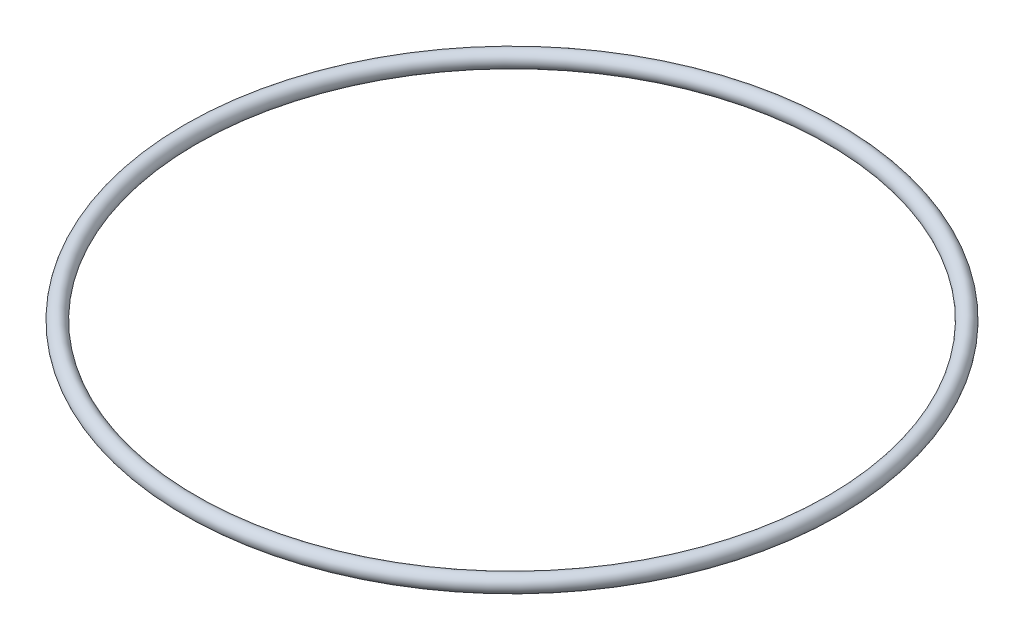
from build123d import *

# Parameters (mm, degrees)
SKETCH9_R = 0.889


with BuildPart() as part:
    # Sweep5: sweep along a path in Sketch6
    with BuildLine(Plane(origin=(0, 0, 0), x_dir=(1, 0, 0), z_dir=(0, 1, 0))) as sweep5_path:
        CenterArc((0, 0), 35.6743, 0, 360)
    # Sketch9 → Sweep5 (sweep)
    with BuildSketch(Plane.XY):
        with Locations((-35.6743, 0)):
            Circle(SKETCH9_R)
    sweep(path=sweep5_path.line)


solid = part.part
